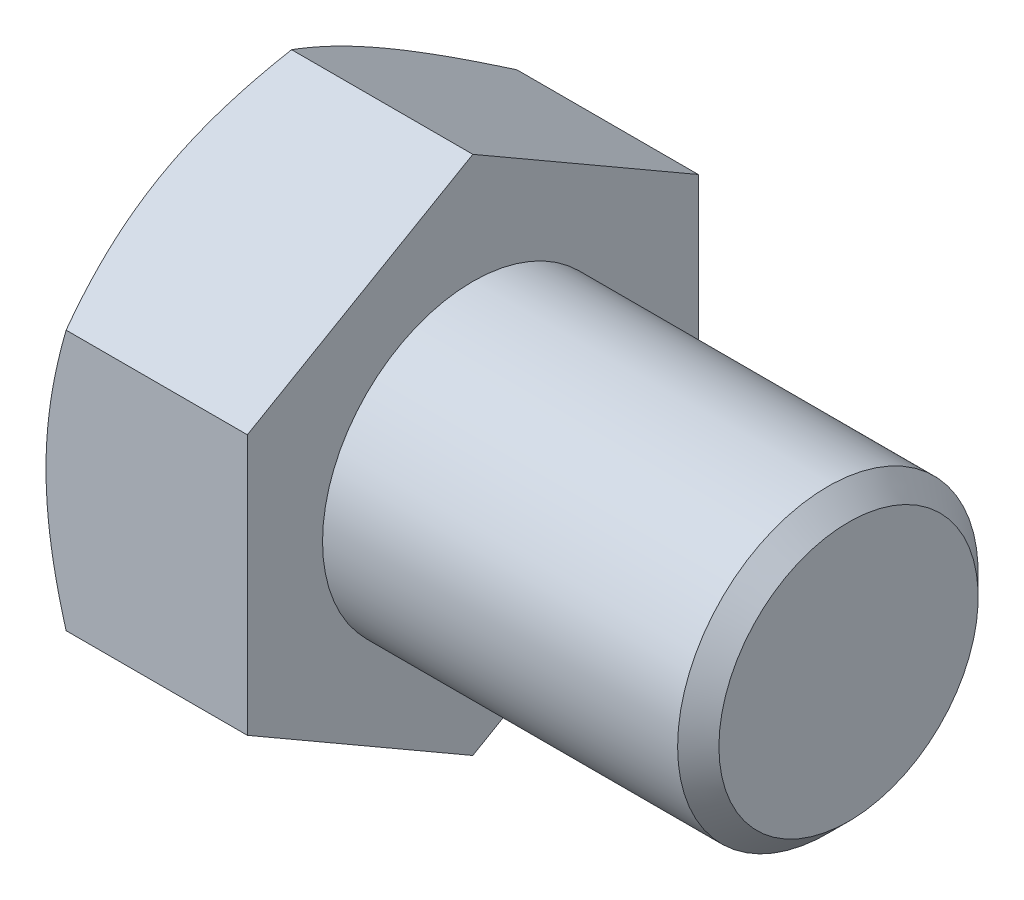
from build123d import *

# Parameters (mm, degrees)
BASEHEAD_DEPTH = 13.4


with BuildPart() as part:
    # Sketch1 → BaseHead (new body)
    with BuildSketch(Plane(origin=(0, 0, 0), x_dir=(0, 0, -1), z_dir=(1, 0, 0))):
        Polygon((15, 8.660254038), (15, -8.660254038), (0, -17.320508076), (-15, -8.660254038), (-15, 8.660254038), (0, 17.320508076), align=None)
    extrude(amount=BASEHEAD_DEPTH)

    # BodySke → BaseBody (revolve)
    with BuildSketch(Plane.XY, mode=Mode.PRIVATE) as basebody_sk:
        Polygon((0, 0), (38.4, 0), (38.4, 8.626), (37.026, 10), (0, 10), align=None)
    revolve(basebody_sk.sketch.rotate(Axis((0, 0, 0), (1, 0, 0)), 90), axis=Axis((0, 0, 0), (1, 0, 0)))

    # Sketch3 → HeadChamfer (revolve, cut)
    with BuildSketch(Plane.XY):
        Polygon((0, 15), (4.226497308, 22.320508076), (4.226497308, 27.320508076), (-10, 27.320508076), (-10, 15), align=None)
    revolve(axis=Axis((0, 0, 0), (1, 0, 0)), mode=Mode.SUBTRACT)


solid = part.part
